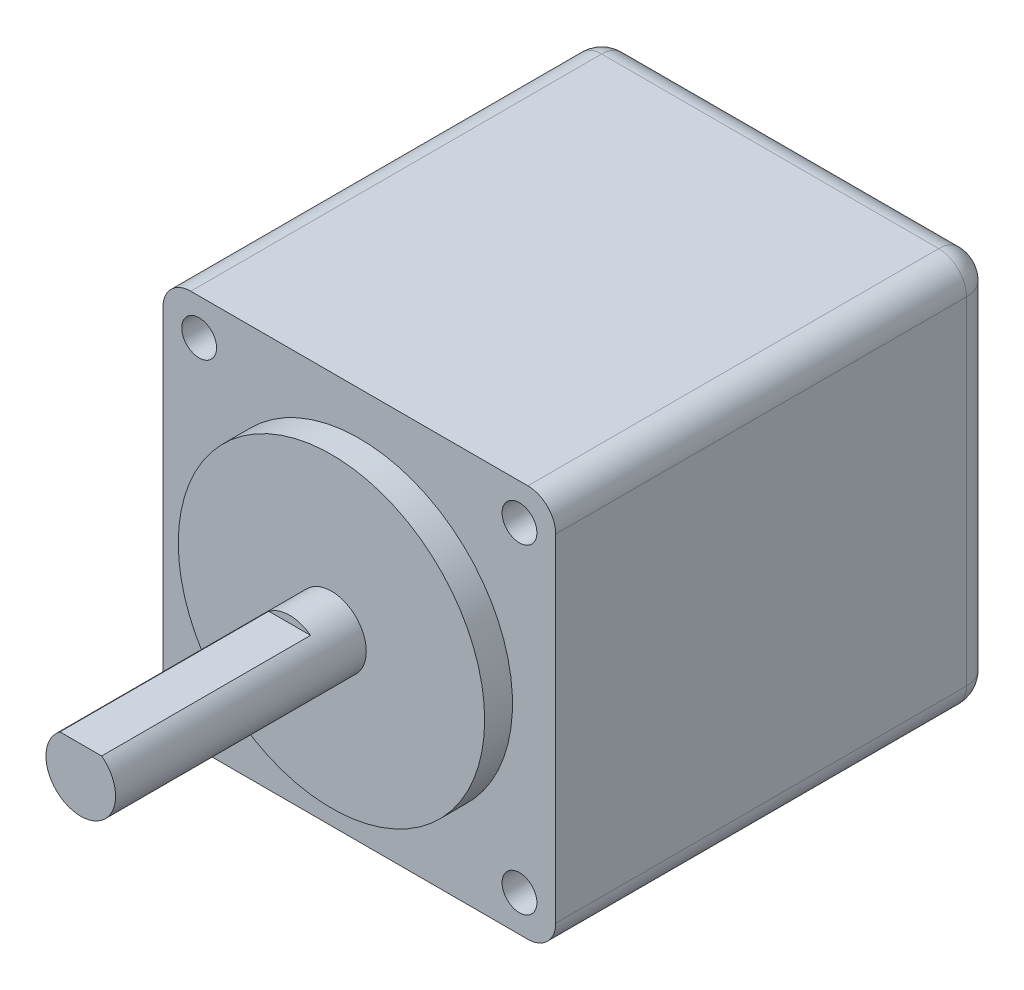
from build123d import *

# Parameters (mm, degrees)
SKETCH1_W           = 28.2
SKETCH1_H           = 28.2
BOSS_EXTRUDE1_DEPTH = 31.5
SKETCH2_R           = 11
BOSS_EXTRUDE2_DEPTH = 2
SKETCH3_R           = 2.5
BOSS_EXTRUDE3_DEPTH = 18
SKETCH4_W           = 15
SKETCH4_H           = 0.5
CUT_EXTRUDE1_DEPTH  = 5
SKETCH5_R           = 1.25
CUT_EXTRUDE2_DEPTH  = 2.5
FILLET1_R           = 2


with BuildPart() as part:
    # Sketch1 → Boss-Extrude1 (new body)
    with BuildSketch(Plane.XY):
        Rectangle(SKETCH1_W, SKETCH1_H)
    extrude(amount=BOSS_EXTRUDE1_DEPTH)

    # Sketch2 → Boss-Extrude2 (add)
    with BuildSketch(Plane.XY.offset(31.5)):
        with Locations(Location((0, 0, 0), (0, 0, 180))):
            Circle(SKETCH2_R)
    extrude(amount=BOSS_EXTRUDE2_DEPTH)

    # Sketch3 → Boss-Extrude3 (add)
    with BuildSketch(Plane.XY.offset(33.5)):
        Circle(SKETCH3_R)
    extrude(amount=BOSS_EXTRUDE3_DEPTH)

    # Sketch4 → Cut-Extrude1 (cut, symmetric)
    with BuildSketch(Plane(origin=(0, 0, 0), x_dir=(0, 0, -1), z_dir=(1, 0, 0))):
        with Locations((-44, 2.25)):
            Rectangle(SKETCH4_W, SKETCH4_H)
    extrude(amount=CUT_EXTRUDE1_DEPTH, both=True, mode=Mode.SUBTRACT)

    # Sketch5 → Cut-Extrude2 (cut)
    with BuildSketch(Plane.XY.offset(31.5)):
        with Locations((-11.5, 11.5)):
            Circle(SKETCH5_R)
        with Locations((11.5, 11.5)):
            Circle(SKETCH5_R)
        with Locations((11.5, -11.5)):
            Circle(SKETCH5_R)
        with Locations((-11.5, -11.5)):
            Circle(SKETCH5_R)
    extrude(amount=-CUT_EXTRUDE2_DEPTH, mode=Mode.SUBTRACT)

    # Fillet1
    fillet1_edges = [part.edges().sort_by_distance(p)[0] for p in [
        (0, -14.1, 0),
        (-14.1, 0, 0),
        (0, 14.1, 0),
        (14.1, 0, 0),
        (14.1, -14.1, 15.75),
        (-14.1, -14.1, 15.75),
        (-14.1, 14.1, 15.75),
        (14.1, 14.1, 15.75),
    ]]
    fillet(fillet1_edges, radius=FILLET1_R)


solid = part.part
